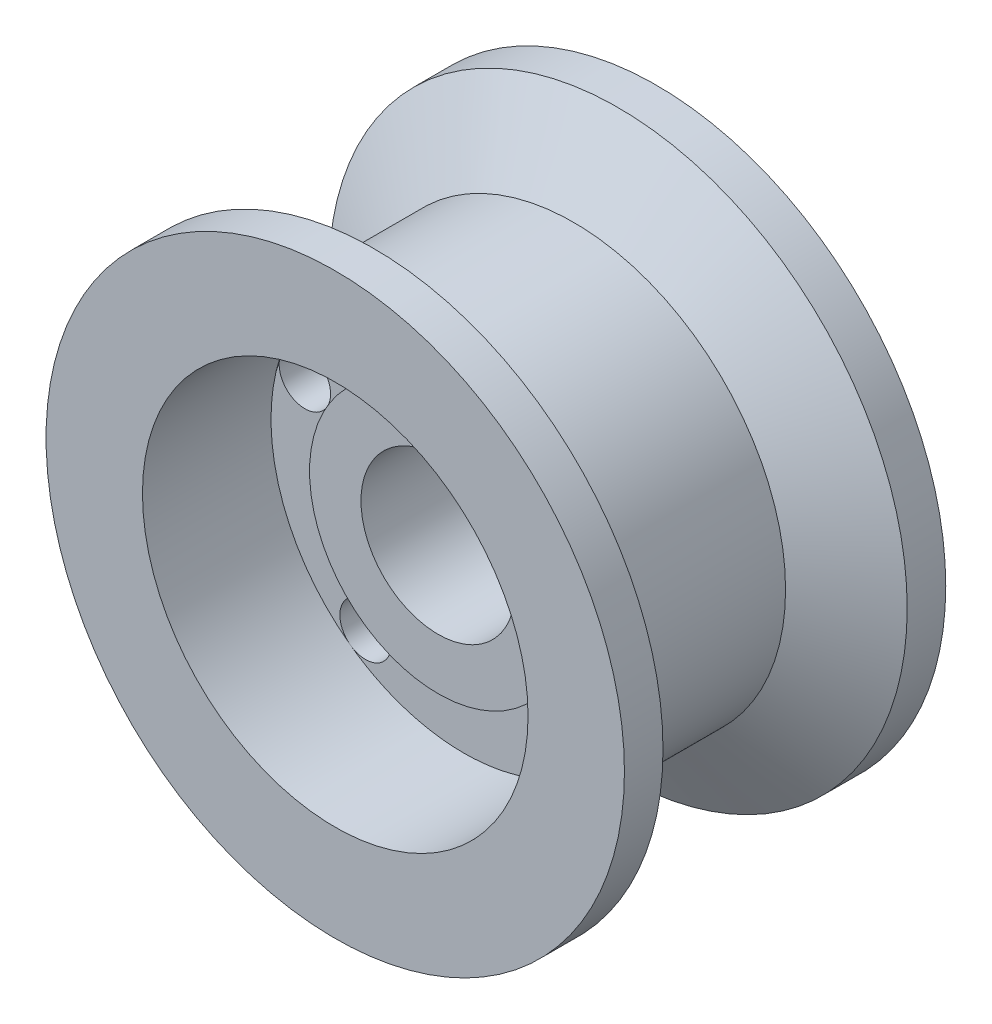
from build123d import *

# Parameters (mm, degrees)
SKETCH1_R                = 22.5
BOSS_EXTRUDE2_DEPTH      = 12.5
SKETCH2_R                = 10
CUT_EXTRUDE1_DEPTH       = 41.466035141
SKETCH3_R                = 15
CUT_EXTRUDE2_DEPTH       = 10
SKETCH4_R                = 2
CUT_EXTRUDE3_DEPTH       = 36.178118199
CIRPATTERN1_COUNT        = 5
BOSS_EXTRUDE3_DEPTH      = 2
BOSS_EXTRUDE3_DEPTH_BACK = 7
SKETCH6_R                = 10
SKETCH6_R_2              = 6


with BuildPart() as part:
    # Sketch1 → Boss-Extrude2 (new, symmetric)
    with BuildSketch(Plane.XY):
        Circle(SKETCH1_R)
    extrude(amount=BOSS_EXTRUDE2_DEPTH, both=True)

    # Sketch2 → Cut-Extrude1 (cut, through all)
    with BuildSketch(Plane.XY.offset(12.5)):
        Circle(SKETCH2_R)
    extrude(amount=-CUT_EXTRUDE1_DEPTH, mode=Mode.SUBTRACT)

    # Sketch3 → Cut-Extrude2 (cut)
    with BuildSketch(Plane.XY.offset(12.5)):
        Circle(SKETCH3_R)
    cut_extrude2 = extrude(amount=-CUT_EXTRUDE2_DEPTH, mode=Mode.SUBTRACT)

    # Mirror1: Cut-Extrude2 across plane
    add(cut_extrude2.mirror(Plane.XY), mode=Mode.SUBTRACT)

    # Sketch4 → Cut-Extrude3 (cut, through all)
    with BuildSketch(Plane.XY.offset(2.5)):
        with Locations(Location((0, 13, 0), (0, 0, 90))):
            Circle(SKETCH4_R)
    cut_extrude3 = extrude(amount=-CUT_EXTRUDE3_DEPTH, mode=Mode.SUBTRACT)

    # CirPattern1: Cut-Extrude3 ×5 about axis
    cirpattern1_axis = Axis((0, 0, 0), (0, 0, 1))
    for i in range(1, CIRPATTERN1_COUNT):
        add(cut_extrude3.rotate(cirpattern1_axis, i * 360 / CIRPATTERN1_COUNT), mode=Mode.SUBTRACT)

    # Sketch5 → Cut-Revolve1 (revolve, cut)
    with BuildSketch(Plane(origin=(0, 0, 0), x_dir=(1, 0, 0), z_dir=(0, 1, 0))):
        Polygon((22.5, 9.5), (22.5, -9.5), (16.5, -6.035898385), (16.5, 6.035898385), align=None)
    revolve(axis=Axis((0, 0, 18.220139874), (0, 0, -1)), mode=Mode.SUBTRACT)

    # Sketch6 → Boss-Extrude3 (add, two sides: drawn at the far end of the back side and taken through both)
    with BuildSketch(Plane.XY.offset(2.5).offset(-BOSS_EXTRUDE3_DEPTH_BACK)):
        Circle(SKETCH6_R)
        Circle(SKETCH6_R_2, mode=Mode.SUBTRACT)
    extrude(amount=BOSS_EXTRUDE3_DEPTH + BOSS_EXTRUDE3_DEPTH_BACK)


solid = part.part
